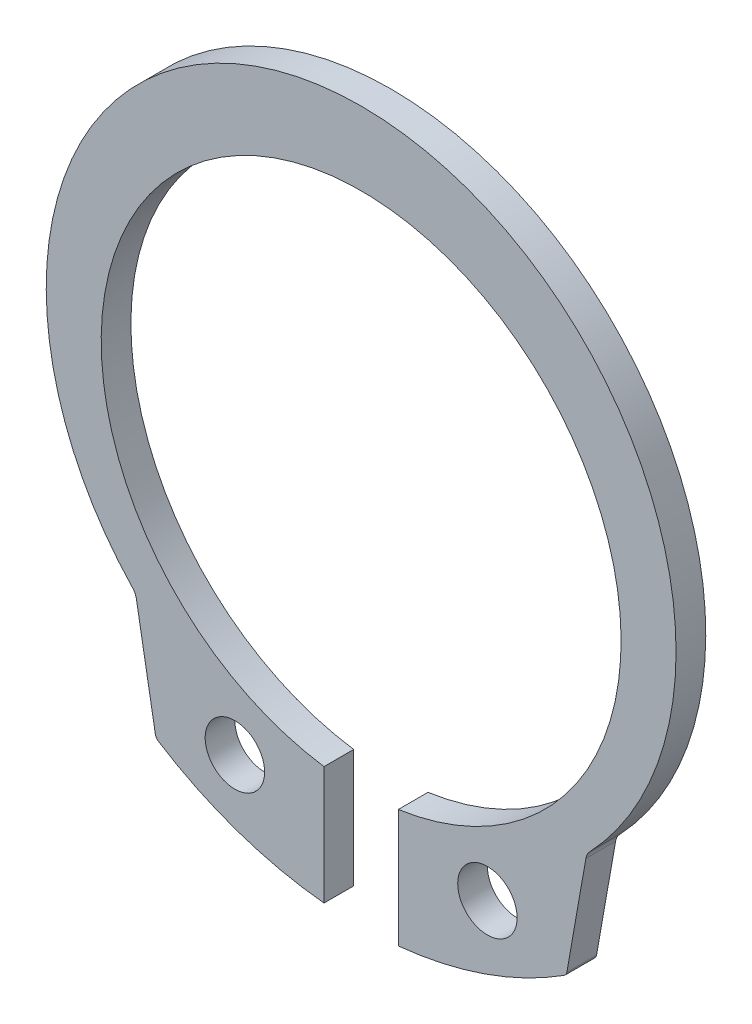
from build123d import *

# Parameters (mm, degrees)
SKETCH1_R  = 1
BODY_DEPTH = 1
FILLET1_R  = 0.2
FILLET2_R  = 0.5


with BuildPart() as part:
    # Sketch1 → Body (new body)
    with BuildSketch(Plane.XY):
        with BuildLine():
            Line((-1.25, -9.280254038), (-1.25, -13.258334542))
            ThreePointArc((-1.25, -13.258334542), (-4.197569907, -12.606259086), (-6.907964473, -11.276923892))
            Line((-6.907964473, -11.276923892), (-7.592035527, -7.397364163))
            ThreePointArc((-7.592035527, -7.397364163), (0, 10.6), (7.592035527, -7.397364163))
            Line((7.592035527, -7.397364163), (6.907964473, -11.276923892))
            ThreePointArc((6.907964473, -11.276923892), (4.197569907, -12.606259086), (1.25, -13.258334542))
            Line((1.25, -13.258334542), (1.25, -9.280254038))
            ThreePointArc((1.25, -9.280254038), (0, 8.13), (-1.25, -9.280254038))
        make_face()
        with Locations(Location((4.25, -10.439750506, 0), (0, 0, 180))):
            Circle(SKETCH1_R, mode=Mode.SUBTRACT)
        with Locations((-4.25, -10.439750506)):
            Circle(SKETCH1_R, mode=Mode.SUBTRACT)
    extrude(amount=-BODY_DEPTH)

    # Fillet1
    fillet1_edges = [part.edges().sort_by_distance(p)[0] for p in [
        (-6.907964473, -11.276923892, -0.5),
        (6.907964473, -11.276923892, -0.5),
    ]]
    fillet(fillet1_edges, radius=FILLET1_R)

    # Fillet2
    fillet2_edges = [part.edges().sort_by_distance(p)[0] for p in [
        (-7.592035527, -7.397364163, -0.5),
        (7.592035527, -7.397364163, -0.5),
    ]]
    fillet(fillet2_edges, radius=FILLET2_R)


solid = part.part
